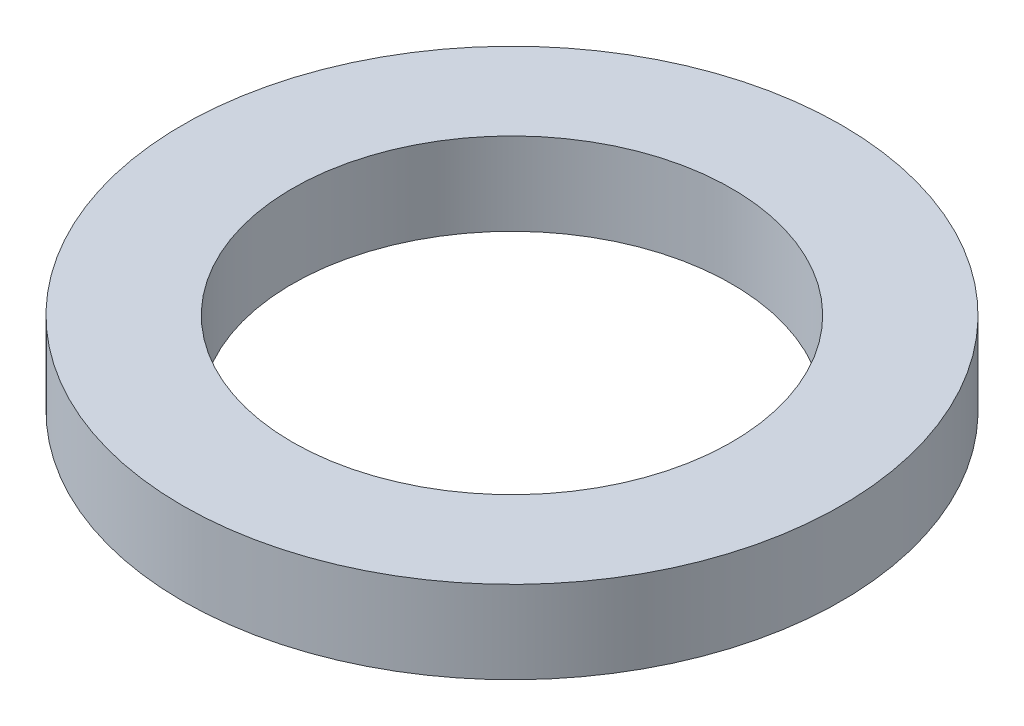
from build123d import *

# Parameters (mm, degrees)
SKETCH1_R           = 4.7625
BOSS_EXTRUDE1_DEPTH = 1.1938
SKETCH5_R           = 3.175
CUT_EXTRUDE1_DEPTH  = 7.840173312


with BuildPart() as part:
    # Sketch1 → Boss-Extrude1 (new body)
    with BuildSketch(Plane(origin=(0, 0, 0), x_dir=(1, 0, 0), z_dir=(0, 1, 0))):
        with Locations(Location((0, 0, 0), (0, 0, 270))):
            Circle(SKETCH1_R)
    extrude(amount=BOSS_EXTRUDE1_DEPTH)

    # Sketch5 → Cut-Extrude1 (cut, through all)
    with BuildSketch(Plane(origin=(0, 1.1938, 0), x_dir=(-1, 0, 0), z_dir=(0, 1, 0))):
        with Locations(Location((0, 0, 0), (0, 0, 90))):
            Circle(SKETCH5_R)
    extrude(amount=-CUT_EXTRUDE1_DEPTH, mode=Mode.SUBTRACT)


solid = part.part
